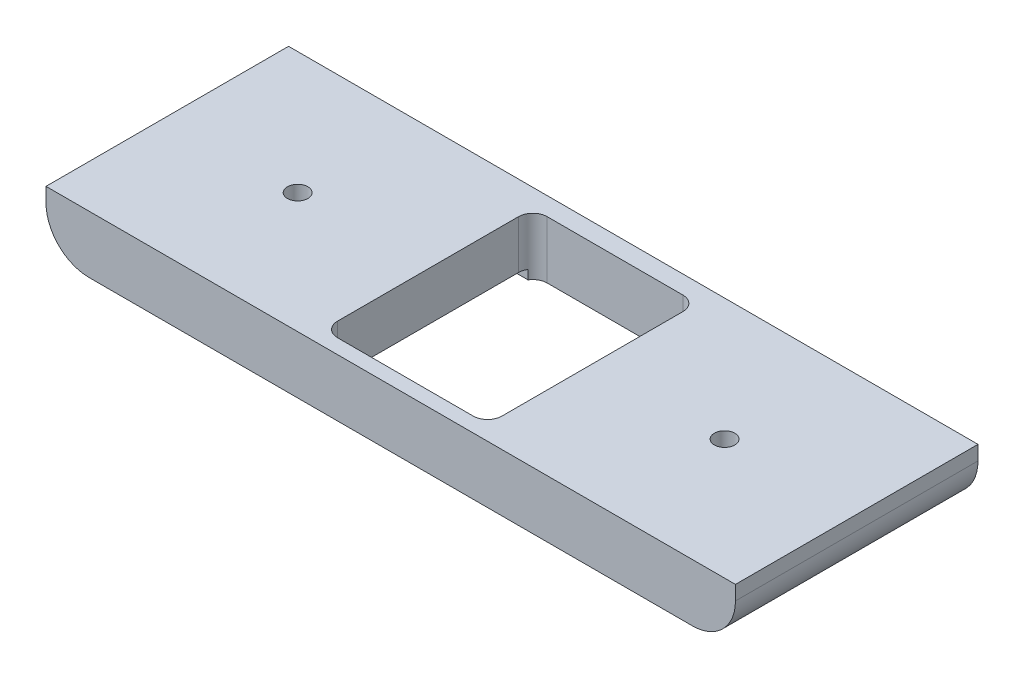
from build123d import *

# Parameters (mm, degrees)
SKETCH1_W               = 76.2
SKETCH1_H               = 26.809375
BOSS_EXTRUDE1_DEPTH     = 6.35
FILLET1_R               = 4.7625
SKETCH2_W               = 21.65
SKETCH2_H               = 1
CUT_EXTRUDE1_DEPTH      = 80.112608871
CUT_EXTRUDE2_DEPTH      = 63.558479955
CUT_EXTRUDE2_DEPTH_BACK = 63.558479955
F_4_40_TAPPED_HOLE1_D   = 2.2606


with BuildPart() as part:
    # Sketch1 → Boss-Extrude1 (new body)
    with BuildSketch(Plane(origin=(0, 0, 0), x_dir=(1, 0, 0), z_dir=(0, 1, 0))):
        with Locations((-20.831303498, 6.894139619)):
            Rectangle(SKETCH1_W, SKETCH1_H)
    extrude(amount=BOSS_EXTRUDE1_DEPTH)

    # Fillet1
    fillet1_edges = [part.edges().sort_by_distance(p)[0] for p in [
        (-58.931303498, 0, -6.894139619),
        (17.268696502, 0, -6.894139619),
    ]]
    fillet(fillet1_edges, radius=FILLET1_R)

    # Sketch2 → Cut-Extrude1 (cut, through all)
    with BuildSketch(Plane(origin=(17.268696502, 0, 0), x_dir=(0, 0, -1), z_dir=(1, 0, 0))):
        with Locations((6.695702119, 0.5)):
            Rectangle(SKETCH2_W, SKETCH2_H)
    extrude(amount=-CUT_EXTRUDE1_DEPTH, mode=Mode.SUBTRACT)

    # Sketch3 → Cut-Extrude2 (cut, two sides: drawn at the far end of the back side and taken through both)
    with BuildSketch(Plane.XZ.offset(-1).offset(-CUT_EXTRUDE2_DEPTH_BACK)):
        with BuildLine():
            Line((-11.743803498, 3.304297881), (-11.743803498, -16.695702119))
            ThreePointArc((-11.743803498, -16.695702119), (-12.208771483, -17.818234134), (-13.331303498, -18.283202119))
            Line((-13.331303498, -18.283202119), (-28.331303498, -18.283202119))
            ThreePointArc((-28.331303498, -18.283202119), (-29.453835513, -17.818234134), (-29.918803498, -16.695702119))
            Line((-29.918803498, -16.695702119), (-29.918803498, 3.304297881))
            ThreePointArc((-29.918803498, 3.304297881), (-29.453835513, 4.426829896), (-28.331303498, 4.891797881))
            Line((-28.331303498, 4.891797881), (-13.331303498, 4.891797881))
            ThreePointArc((-13.331303498, 4.891797881), (-12.208771483, 4.426829896), (-11.743803498, 3.304297881))
        make_face()
    extrude(amount=CUT_EXTRUDE2_DEPTH + CUT_EXTRUDE2_DEPTH_BACK, mode=Mode.SUBTRACT)

    # #4-40 Tapped Hole1 (through all)
    with Locations(Plane(origin=(0, 6.35, 0), x_dir=(-1, 0, 0), z_dir=(0, 1, 0))):
        with Locations((44.425053498, -6.794920869), (-2.762446502, -6.794920869)):
            Hole(F_4_40_TAPPED_HOLE1_D / 2)


solid = part.part
